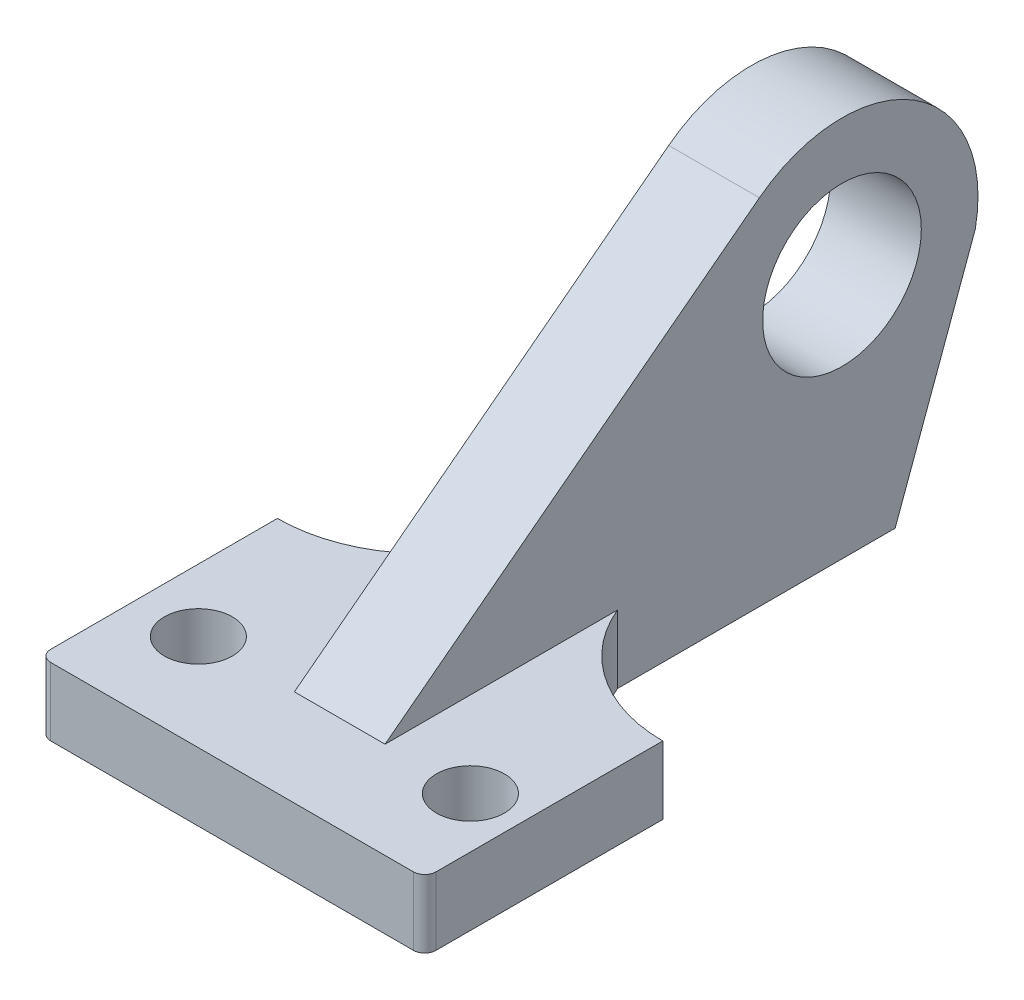
from build123d import *

# Parameters (mm, degrees)
SKETCH3_R           = 6
BOSS_EXTRUDE3_DEPTH = 12
SKETCH4_R           = 14
BOSS_EXTRUDE4_DEPTH = 8


with BuildPart() as part:
    # Sketch3 → Boss-Extrude3 (new body)
    with BuildSketch(Plane(origin=(0, 0, 0), x_dir=(1, 0, 0), z_dir=(0, 1, 0))):
        with BuildLine():
            ThreePointArc((-29.532846715, 2), (-28.947060278, 0.585786438), (-27.532846715, 0))
            Line((-27.532846715, 0), (36.467153285, 0))
            ThreePointArc((36.467153285, 0), (37.881366847, 0.585786438), (38.467153285, 2))
            Line((38.467153285, 2), (38.467153285, 42))
            ThreePointArc((38.467153285, 42), (20.082376974, 49.615223689), (12.467153285, 68))
            Line((12.467153285, 68), (-3.532846715, 68))
            ThreePointArc((-3.532846715, 68), (-11.148070404, 49.615223689), (-29.532846715, 42))
            Line((-29.532846715, 42), (-29.532846715, 2))
        make_face()
        with Locations(Location((-18.474270286, 17, 0), (0, 0, 270))):
            Circle(SKETCH3_R, mode=Mode.SUBTRACT)
        with Locations(Location((29.525729714, 17, 0), (0, 0, 270))):
            Circle(SKETCH3_R, mode=Mode.SUBTRACT)
    extrude(amount=-BOSS_EXTRUDE3_DEPTH)

    # Sketch4 → Boss-Extrude4 (add, symmetric)
    with BuildSketch(Plane(origin=(6.467153285, 0, 0), x_dir=(0, 0, -1), z_dir=(1, 0, 0))):
        with BuildLine():
            Line((17, 0), (83.047673955, 50.469532025))
            ThreePointArc((83.047673955, 50.469532025), (110.346676743, 51.747263432), (121.143218593, 26.641430746))
            Line((121.143218593, 26.641430746), (107, -12))
            Line((107, -12), (17, -12))
            Line((17, -12), (17, 0))
        make_face()
        with Locations((97.619641201, 31.399718953)):
            Circle(SKETCH4_R, mode=Mode.SUBTRACT)
    extrude(amount=BOSS_EXTRUDE4_DEPTH, both=True)


solid = part.part
